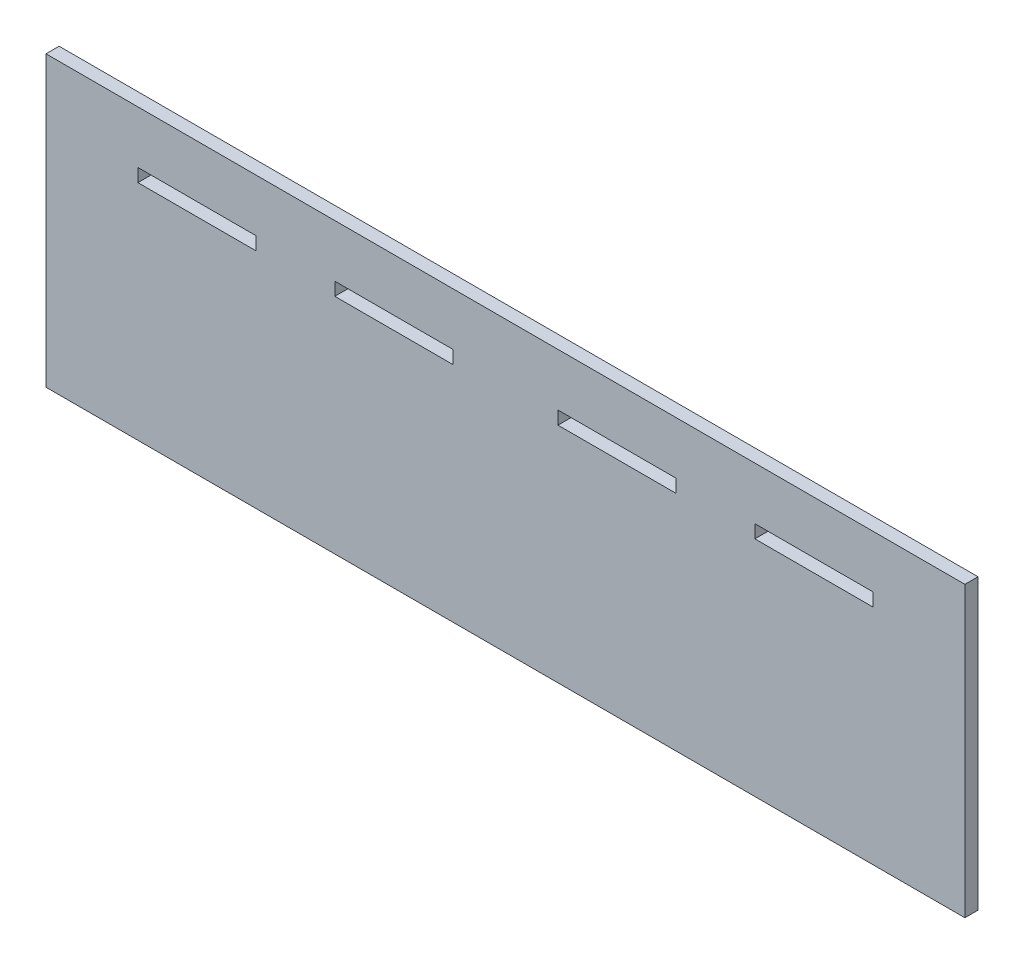
from build123d import *

# Parameters (mm, degrees)
ESQUISSE1_W        = 700
ESQUISSE1_H        = 220
ESQUISSE1_W_2      = 90
ESQUISSE1_H_2      = 10
BOSS_EXTRU_1_DEPTH = 10


with BuildPart() as part:
    # Esquisse1 → Boss.-Extru.1 (new body)
    with BuildSketch(Plane.XY):
        with Locations((350, 110)):
            Rectangle(ESQUISSE1_W, ESQUISSE1_H)
        with Locations((265, 175)):
            Rectangle(ESQUISSE1_W_2, ESQUISSE1_H_2, mode=Mode.SUBTRACT)
        with Locations((435, 175)):
            Rectangle(ESQUISSE1_W_2, ESQUISSE1_H_2, mode=Mode.SUBTRACT)
        with Locations((585, 175)):
            Rectangle(ESQUISSE1_W_2, ESQUISSE1_H_2, mode=Mode.SUBTRACT)
        with Locations((115, 175)):
            Rectangle(ESQUISSE1_W_2, ESQUISSE1_H_2, mode=Mode.SUBTRACT)
    extrude(amount=BOSS_EXTRU_1_DEPTH)


solid = part.part
